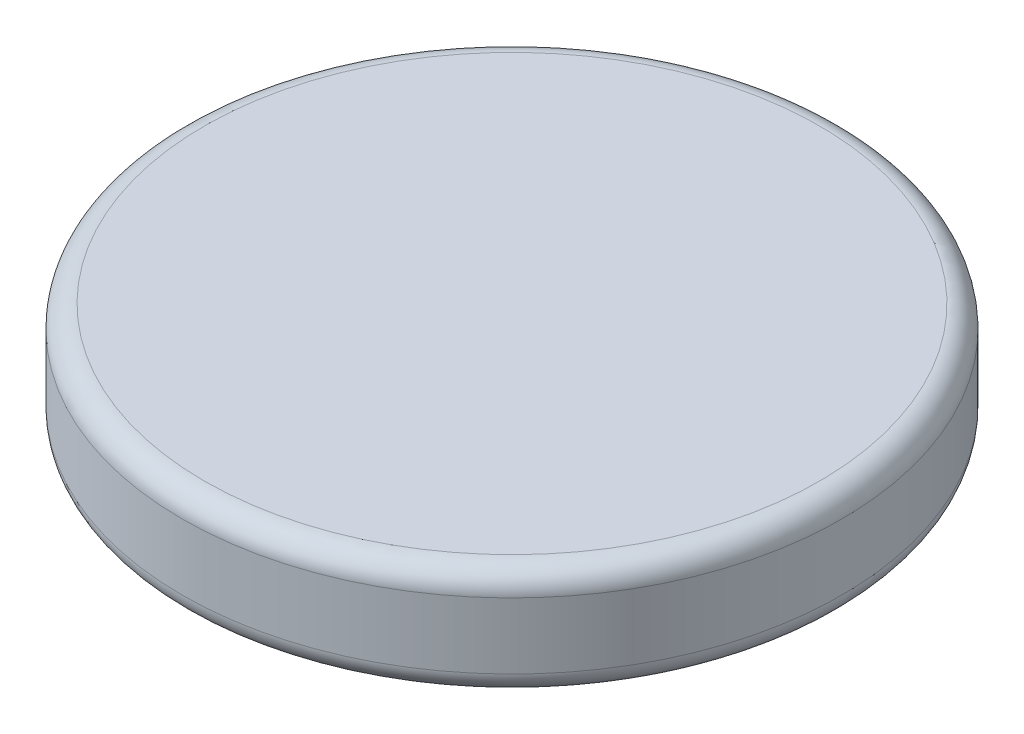
from build123d import *

# Parameters (mm, degrees)
SKETCH_1_R      = 3
EXTRUDE_1_DEPTH = 1
FILLET_1_R      = 0.2


with BuildPart() as part:
    # Эскиз1 → Бобышка-Вытянуть1 (new body)
    with BuildSketch(Plane(origin=(0, 0, 0), x_dir=(1, 0, 0), z_dir=(0, 1, 0))):
        with Locations(Location((0, 0, 0), (0, 0, 270))):
            Circle(SKETCH_1_R)
    extrude(amount=EXTRUDE_1_DEPTH)

    # Скругление1
    fillet_1_edges = [part.edges().sort_by_distance(p)[0] for p in [
        (0, 0, -3),
        (0, 1, -3),
    ]]
    fillet(fillet_1_edges, radius=FILLET_1_R)


solid = part.part
